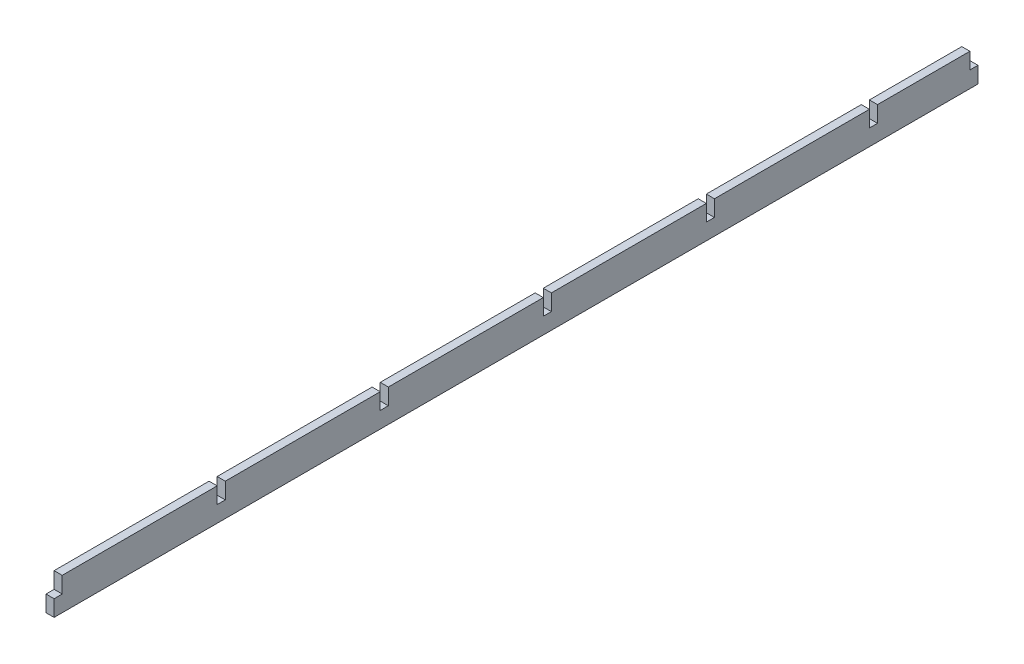
from build123d import *

# Parameters (mm, degrees)
SKETCH1_W           = 361.95
SKETCH1_H           = 12.7
BOSS_EXTRUDE1_DEPTH = 3.175
SKETCH2_W           = 3.175
SKETCH2_H           = 6.35
CUT_EXTRUDE1_DEPTH  = 5.715


with BuildPart() as part:
    # Sketch1 → Boss-Extrude1 (new body)
    with BuildSketch(Plane(origin=(0, 0, 0), x_dir=(0, 0, -1), z_dir=(1, 0, 0))):
        with Locations((180.975, 6.35)):
            Rectangle(SKETCH1_W, SKETCH1_H)
    extrude(amount=BOSS_EXTRUDE1_DEPTH)

    # Sketch2 → Cut-Extrude1 (cut)
    with BuildSketch(Plane(origin=(3.175, 0, 0), x_dir=(0, 0, -1), z_dir=(1, 0, 0))):
        with Locations((1.5875, 9.525)):
            Rectangle(SKETCH2_W, SKETCH2_H)
        with Locations((65.4685, 9.525)):
            Rectangle(SKETCH2_W, SKETCH2_H)
        with Locations((129.3495, 9.525)):
            Rectangle(SKETCH2_W, SKETCH2_H)
        with Locations((193.2305, 9.525)):
            Rectangle(SKETCH2_W, SKETCH2_H)
        with Locations((257.1115, 9.525)):
            Rectangle(SKETCH2_W, SKETCH2_H)
        with Locations((320.9925, 9.525)):
            Rectangle(SKETCH2_W, SKETCH2_H)
        with Locations((360.3625, 9.525)):
            Rectangle(SKETCH2_W, SKETCH2_H)
    extrude(amount=-CUT_EXTRUDE1_DEPTH, mode=Mode.SUBTRACT)


solid = part.part
